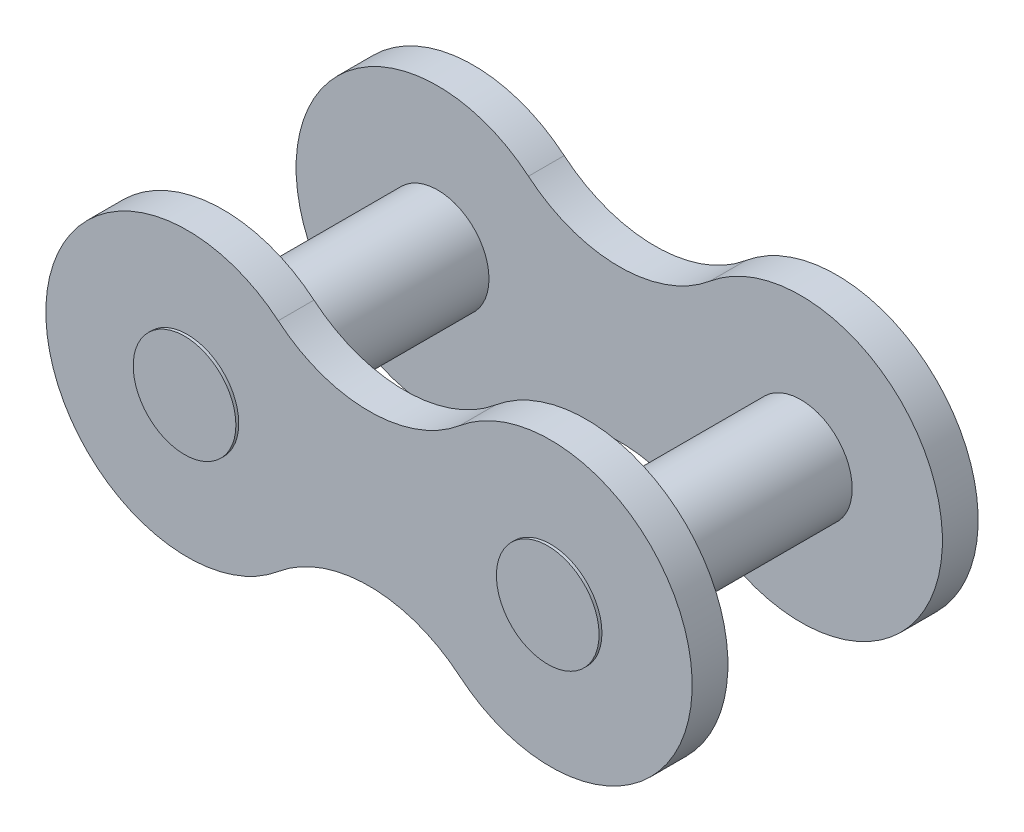
from build123d import *

# Parameters (mm, degrees)
SKETCH_2_R           = 1.795
EXTRUDE_1_DEPTH      = 1.25
EXTRUDE_2_DEPTH      = 5.1
EXTRUDE_2_DEPTH_BACK = 5.1
SKETCH_1_R           = 1.795


with BuildPart() as part:
    # Эскиз2 → Бобышка-Вытянуть1 (new body)
    with BuildSketch(Plane.XY.offset(5)):
        with BuildLine():
            ThreePointArc((3.175, -8.746386407), (11.3, -4.948772024), (3.175, -1.151157641))
            ThreePointArc((3.175, -1.151157641), (0, -2.303543258), (-3.175, -1.151157641))
            ThreePointArc((-3.175, -1.151157641), (-11.3, -4.948772024), (-3.175, -8.746386407))
            ThreePointArc((-3.175, -8.746386407), (0, -7.594000789), (3.175, -8.746386407))
        make_face()
        with Locations((6.35, -4.948772024)):
            Circle(SKETCH_2_R, mode=Mode.SUBTRACT)
        with Locations((-6.35, -4.948772024)):
            Circle(SKETCH_2_R, mode=Mode.SUBTRACT)
    extrude(amount=-EXTRUDE_1_DEPTH)


with BuildPart() as body_2:
    # Зеркальное отражение3: mirrored copy
    add(part.part.mirror(Plane.XY))


with BuildPart() as part_1:
    add(part.part)

    add(body_2.part)  # Бобышка-Вытянуть2 merges body 2
    # Эскиз1 → Бобышка-Вытянуть2 (add, two sides: drawn at the far end of the back side and taken through both)
    with BuildSketch(Plane.XY.offset(-EXTRUDE_2_DEPTH_BACK)):
        with Locations((6.35, -4.948772024)):
            Circle(SKETCH_1_R)
        with Locations((-6.35, -4.948772024)):
            Circle(SKETCH_1_R)
    extrude(amount=EXTRUDE_2_DEPTH + EXTRUDE_2_DEPTH_BACK)


solid = part_1.part
